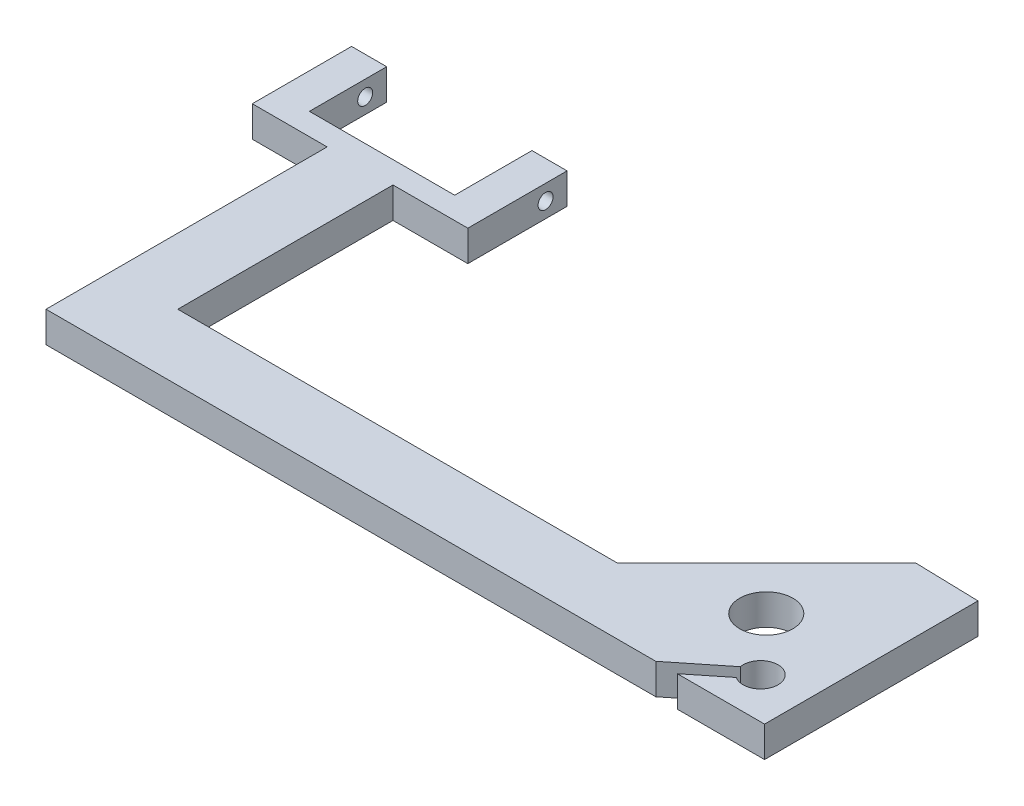
from build123d import *

# Parameters (mm, degrees)
SKETCH1_R           = 6.05
BOSS_EXTRUDE1_DEPTH = 7
SKETCH3_R           = 1.7
CUT_EXTRUDE2_DEPTH  = 60


with BuildPart() as part:
    # Sketch1 → Boss-Extrude1 (new body)
    with BuildSketch(Plane(origin=(0, 0, 0), x_dir=(1, 0, 0), z_dir=(0, 1, 0))):
        with BuildLine():
            Line((-86.41, -26.165178012), (-86.41, -43.765178012))
            Line((-86.41, -43.765178012), (-53.34, -43.765178012))
            Line((-53.34, -43.765178012), (-53.34, -26.165178012))
            Line((-53.34, -26.165178012), (-45.34, -26.165178012))
            Line((-45.34, -26.165178012), (-45.34, -48.765178012))
            Line((-45.34, -48.765178012), (-62.375, -48.765178012))
            Line((-62.375, -48.765178012), (-62.375, -97.765178012))
            Line((-62.375, -97.765178012), (37.625, -97.765178012))
            Line((37.625, -97.765178012), (71.6, -63.790178012))
            Line((71.6, -63.790178012), (86.215, -64.175178012))
            Line((86.215, -64.175178012), (86.215, -112.765178012))
            Line((86.215, -112.765178012), (66.349963518, -112.765178012))
            Line((66.349963518, -112.765178012), (73.821063238, -106.783510987))
            ThreePointArc((73.821063238, -106.783510987), (79.369481987, -101.331578198), (72.140531111, -104.203997211))
            Line((72.140531111, -104.203997211), (61.447619718, -112.765178012))
            Line((61.447619718, -112.765178012), (37.625, -112.765178012))
            Line((37.625, -112.765178012), (-77.375, -112.765178012))
            Line((-77.375, -112.765178012), (-77.375, -48.765178012))
            Line((-77.375, -48.765178012), (-94.41, -48.765178012))
            Line((-94.41, -48.765178012), (-94.41, -26.165178012))
            Line((-94.41, -26.165178012), (-86.41, -26.165178012))
        make_face()
        with Locations(Location((64.6, -90.765178012, 0), (0, 0, 270))):
            Circle(SKETCH1_R, mode=Mode.SUBTRACT)
    extrude(amount=BOSS_EXTRUDE1_DEPTH)

    # Sketch3 → Cut-Extrude2 (cut)
    with BuildSketch(Plane(origin=(-45.34, 0, 0), x_dir=(0, 0, -1), z_dir=(1, 0, 0))):
        with Locations((-31.065178012, 3.5)):
            Circle(SKETCH3_R)
    extrude(amount=-CUT_EXTRUDE2_DEPTH, mode=Mode.SUBTRACT)


solid = part.part
